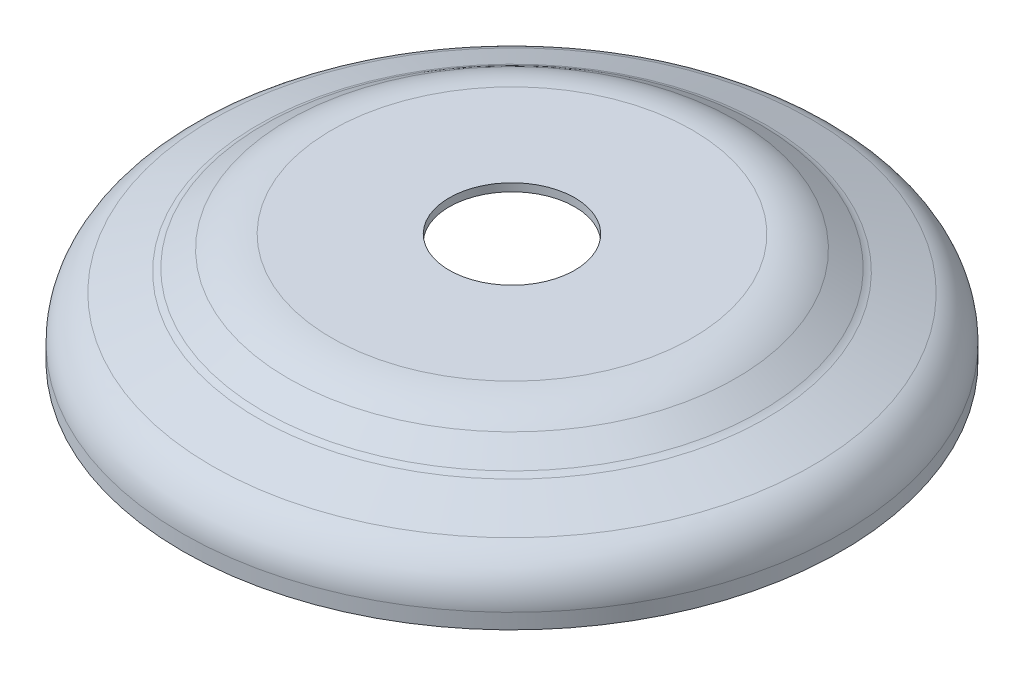
from build123d import *


with BuildPart() as part:
    # Sketch2 → Revolve1 (revolve)
    with BuildSketch(Plane(origin=(0, 0, 0), x_dir=(0, 0, -1), z_dir=(1, 0, 0))):
        with BuildLine():
            Line((4, 7), (11.486121811, 7))
            ThreePointArc((11.486121811, 7), (12.935042555, 6.785460132), (14.259622792, 6.160251472))
            Line((14.259622792, 6.160251472), (15.826730586, 5.115512943))
            ThreePointArc((15.826730586, 5.115512943), (16.005033586, 5.009569), (16.193349625, 4.92266015))
            Line((16.193349625, 4.92266015), (19.114172029, 3.754331188))
            ThreePointArc((19.114172029, 3.754331188), (20.484201691, 2.650787544), (21, 0.968901116))
            Line((21, 0.968901116), (21, 0))
            Line((21, 0), (20.5, 0))
            Line((20.5, 0), (20.5, 0.968901116))
            ThreePointArc((20.5, 0.968901116), (20.070168076, 2.370473139), (18.928476691, 3.290092843))
            Line((18.928476691, 3.290092843), (16.007654287, 4.458421804))
            ThreePointArc((16.007654287, 4.458421804), (15.772259237, 4.567057866), (15.549380487, 4.699487796))
            Line((15.549380487, 4.699487796), (13.982272694, 5.744226325))
            ThreePointArc((13.982272694, 5.744226325), (12.79015048, 6.306914119), (11.486121811, 6.5))
            Line((11.486121811, 6.5), (4, 6.5))
            Line((4, 6.5), (4, 7))
        make_face()
    revolve(axis=Axis((0, 0, 0), (0, 1, 0)))


solid = part.part
